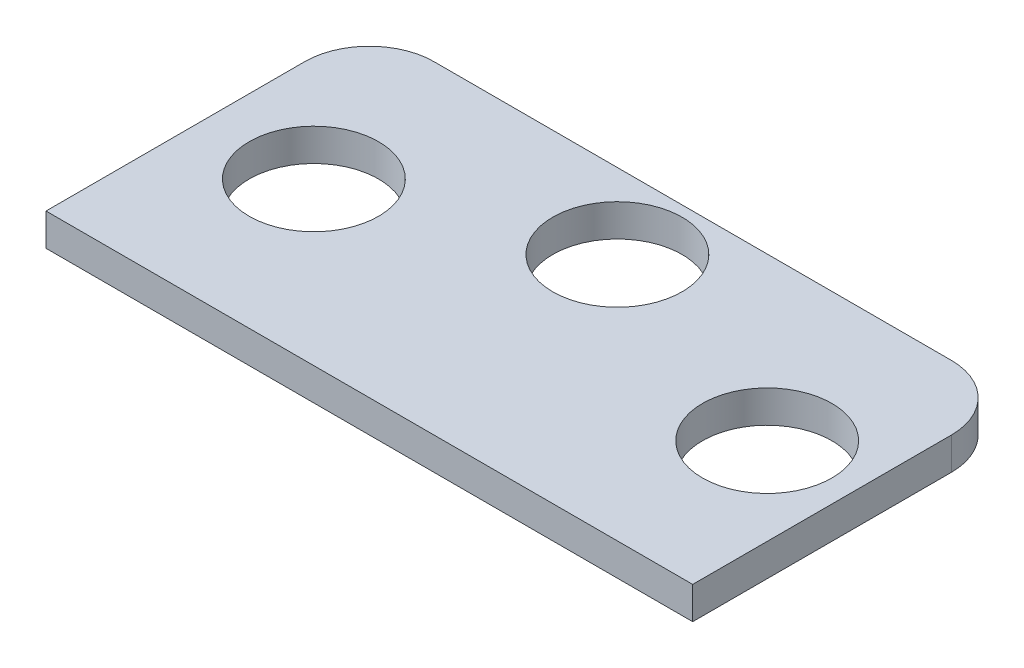
from build123d import *

# Parameters (mm, degrees)
SKETCH1_R           = 20
BOSS_EXTRUDE3_DEPTH = 10


with BuildPart() as part:
    # Sketch1 → Boss-Extrude3 (new body)
    with BuildSketch(Plane(origin=(0, 0, 0), x_dir=(1, 0, 0), z_dir=(0, 1, 0))):
        with BuildLine():
            Line((-80, 50), (80, 50))
            ThreePointArc((80, 50), (94.142135624, 44.142135624), (100, 30))
            Line((100, 30), (100, -50))
            Line((100, -50), (-100, -50))
            Line((-100, -50), (-100, 30))
            ThreePointArc((-100, 30), (-94.142135624, 44.142135624), (-80, 50))
        make_face()
        with Locations(Location((0, 26.715686275, 0), (0, 0, 270))):
            Circle(SKETCH1_R, mode=Mode.SUBTRACT)
        with Locations(Location((73.039215686, 0, 0), (0, 0, 270))):
            Circle(SKETCH1_R, mode=Mode.SUBTRACT)
        with Locations(Location((-67.156862745, 0, 0), (0, 0, 270))):
            Circle(SKETCH1_R, mode=Mode.SUBTRACT)
    extrude(amount=BOSS_EXTRUDE3_DEPTH)


solid = part.part
